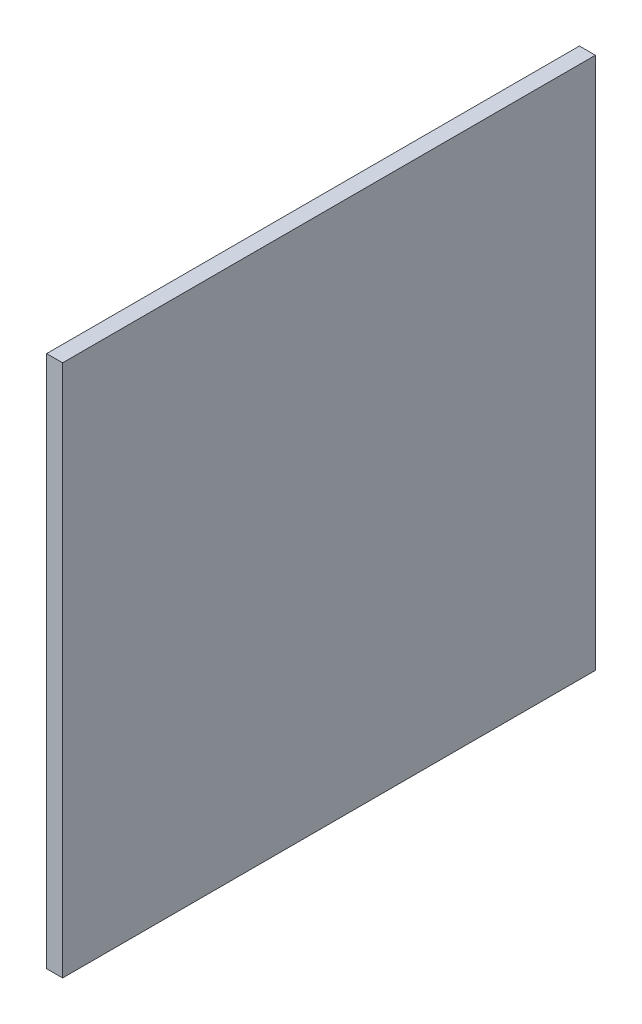
from build123d import *

# Parameters (mm, degrees)
SKETCH1_W           = 15
SKETCH1_H           = 500
BOSS_EXTRUDE1_DEPTH = 500


with BuildPart() as part:
    # Sketch1 → Boss-Extrude1 (new body)
    with BuildSketch(Plane.XY):
        with Locations((7.5, 250)):
            Rectangle(SKETCH1_W, SKETCH1_H)
    extrude(amount=BOSS_EXTRUDE1_DEPTH)


solid = part.part
